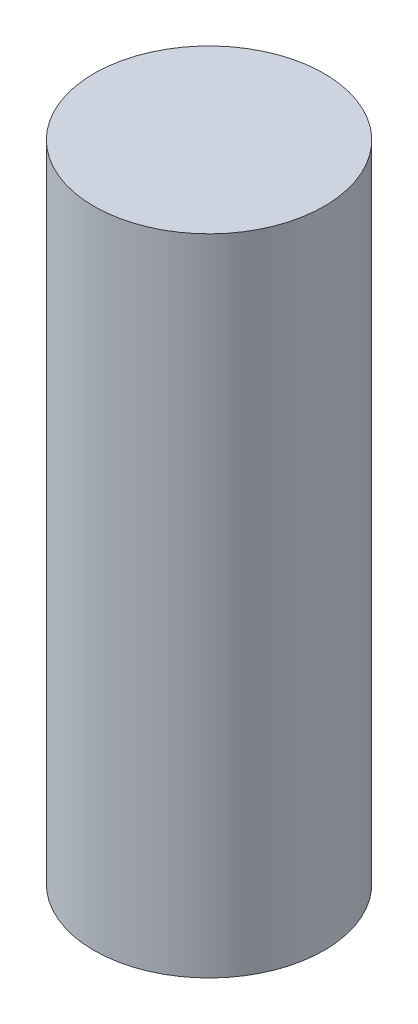
from build123d import *

# Parameters (mm, degrees)
SKETCH1_R           = 31.75
BOSS_EXTRUDE1_DEPTH = 177.8


with BuildPart() as part:
    # Sketch1 → Boss-Extrude1 (new body)
    with BuildSketch(Plane(origin=(0, 0, 0), x_dir=(1, 0, 0), z_dir=(0, 1, 0))):
        with Locations(Location((0, 0, 0), (0, 0, 270))):
            Circle(SKETCH1_R)
    extrude(amount=BOSS_EXTRUDE1_DEPTH)


solid = part.part
